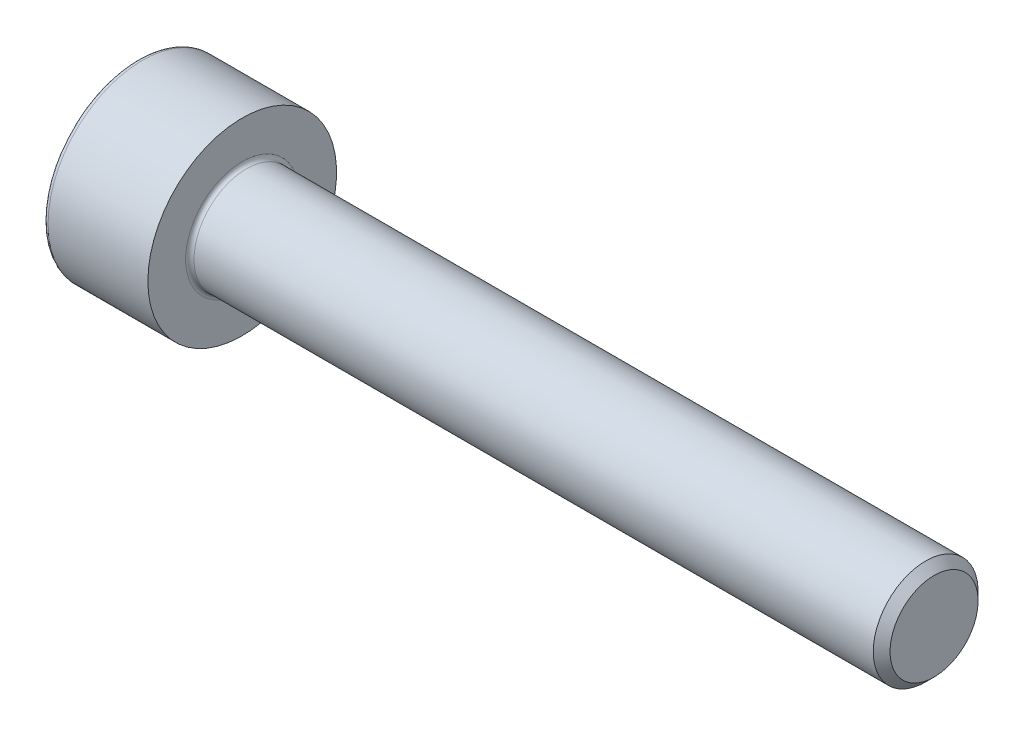
from build123d import *

# Parameters (mm, degrees)
FILLET1_R      = 0.1
FILLET2_R      = 0.12
CHAMFER1_SIZE  = 0.2
EXTRUDE1_DEPTH = 1


with BuildPart() as part:
    # Sketch1 → Revolve1 (revolve)
    with BuildSketch(Plane.XY, mode=Mode.PRIVATE) as revolve1_sk:
        Polygon((2.5, 1.25), (2.5, 0), (4.279914881, 0), (19, 0), (19, 1.25), align=None)
        Polygon((0, 2.25), (0, 0), (2.5, 0), (2.5, 1.25), (2.5, 2.25), align=None)
    revolve(revolve1_sk.sketch.rotate(Axis((0, 0, 0), (1, 0, 0)), 90), axis=Axis((0, 0, 0), (1, 0, 0)))

    # Fillet1
    fillet1_edges = [part.edges().sort_by_distance(p)[0] for p in [
        (2.5, 0, -1.25),
    ]]
    fillet(fillet1_edges, radius=FILLET1_R)

    # Fillet2
    fillet2_edges = [part.edges().sort_by_distance(p)[0] for p in [
        (0, 0, -2.25),
    ]]
    fillet(fillet2_edges, radius=FILLET2_R)

    # Chamfer1
    chamfer1_edges = [part.edges().sort_by_distance(p)[0] for p in [
        (19, 0, -1.25),
    ]]
    chamfer(chamfer1_edges, length=CHAMFER1_SIZE)

    # Sketch2 → Extrude1 (cut)
    with BuildSketch(Plane.ZY):
        Polygon((0, 1.154700538), (-1, 0.577350269), (-1, -0.577350269), (0, -1.154700538), (1, -0.577350269), (1, 0.577350269), align=None)
    extrude(amount=-EXTRUDE1_DEPTH, mode=Mode.SUBTRACT)


solid = part.part
